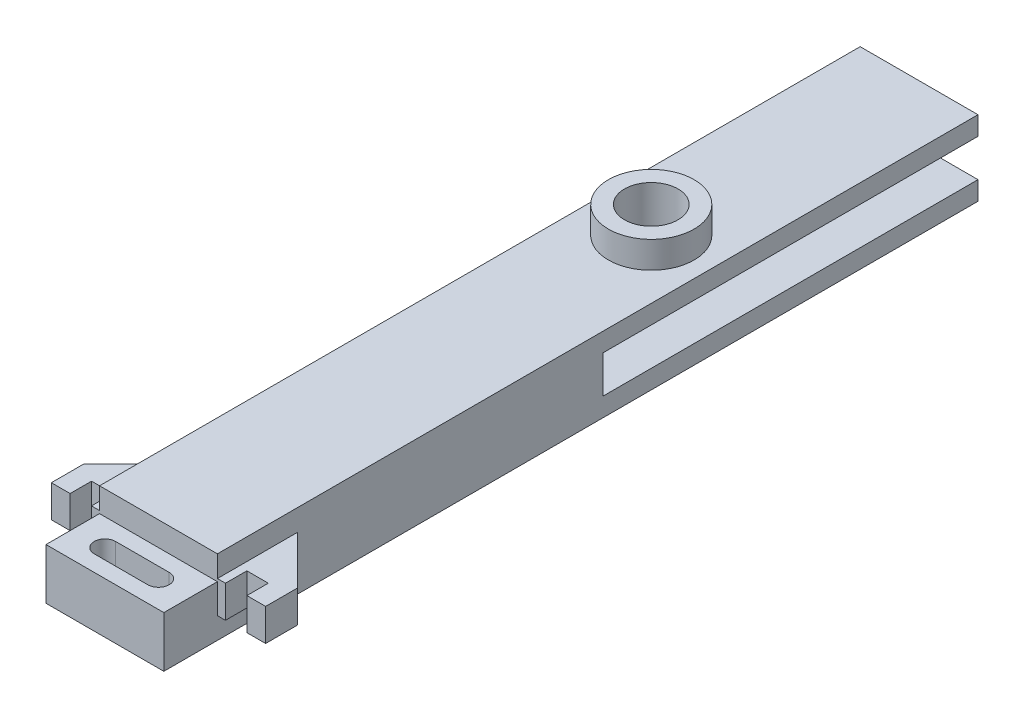
from build123d import *

# Parameters (mm, degrees)
SKETCH1_W           = 11
SKETCH1_H           = 76
BOSS_EXTRUDE1_DEPTH = 7
SKETCH4_R           = 2.5
SKETCH5_W           = 3
SKETCH5_H           = 3
BOSS_EXTRUDE2_DEPTH = 4.5
SKETCH6_W           = 2
SKETCH6_H           = 4
CUT_EXTRUDE2_DEPTH  = 2
BOSS_EXTRUDE3_DEPTH = 3
SKETCH10_W          = 11
SKETCH10_H          = 3.5
CUT_EXTRUDE5_DEPTH  = 35
CUT_EXTRUDE6_REACH  = 41.912
SKETCH11_R          = 2.5
SKETCH12_W          = 11
SKETCH12_H          = 2.25
CUT_EXTRUDE9_DEPTH  = 5
CUT_EXTRUDE10_REACH = 41.58
BOSS_EXTRUDE4_START = 2.5
SKETCH15_R          = 4
SKETCH15_R_2        = 2.5
BOSS_EXTRUDE4_DEPTH = 2.5


with BuildPart() as part:
    # Sketch1 → Boss-Extrude1 (new body)
    with BuildSketch(Plane(origin=(0, 0, 0), x_dir=(1, 0, 0), z_dir=(0, 1, 0))):
        Rectangle(SKETCH1_W, SKETCH1_H)
    extrude(amount=BOSS_EXTRUDE1_DEPTH)

    # Cut-Sweep2: sweep along a path in Sketch3
    with BuildLine(Plane.ZY) as cut_sweep2_path:
        Line((-38, 3.5), (28, 3.5))
        ThreePointArc((28, 3.5), (30.121320344, 2.621320344), (31, 0.5))
        Line((31, 0.5), (31, 0))
    # Sketch4 → Cut-Sweep2 (sweep, cut)
    with BuildSketch(Plane(origin=(0, 0, -38), x_dir=(-1, 0, 0), z_dir=(0, 0, -1))):
        with Locations((0, 3.5)):
            Circle(SKETCH4_R)
    sweep(path=cut_sweep2_path.line, mode=Mode.SUBTRACT)

    # Sketch5 → Boss-Extrude2 (add)
    with BuildSketch(Plane.ZY.offset(5.5)):
        with Locations((31.5, 3.5)):
            Rectangle(SKETCH5_W, SKETCH5_H)
    boss_extrude2 = extrude(amount=BOSS_EXTRUDE2_DEPTH)

    # Mirror1: Boss-Extrude2 across plane
    add(boss_extrude2.mirror(Plane.ZY))

    # Sketch6 → Cut-Extrude2 (cut)
    with BuildSketch(Plane.XY.offset(33)):
        with Locations((-7.25, 4)):
            Rectangle(SKETCH6_W, SKETCH6_H)
    cut_extrude2 = extrude(amount=-CUT_EXTRUDE2_DEPTH, mode=Mode.SUBTRACT)

    # Mirror2: Cut-Extrude2 across plane
    add(cut_extrude2.mirror(Plane.ZY), mode=Mode.SUBTRACT)

    # Sketch7 → Boss-Extrude3 (add)
    with BuildSketch(Plane(origin=(0, 5, 0), x_dir=(1, 0, 0), z_dir=(0, 1, 0))):
        Polygon((-10, -30), (-5.5, -25.5), (-5.5, -30), align=None)
    boss_extrude3 = extrude(amount=-BOSS_EXTRUDE3_DEPTH)

    # Mirror3: Boss-Extrude3 across plane
    add(boss_extrude3.mirror(Plane.ZY))

    # Sketch10 → Cut-Extrude5 (cut)
    with BuildSketch(Plane(origin=(0, 0, -38), x_dir=(-1, 0, 0), z_dir=(0, 0, -1))):
        with Locations((0, 3.5)):
            Rectangle(SKETCH10_W, SKETCH10_H)
    extrude(amount=-CUT_EXTRUDE5_DEPTH, mode=Mode.SUBTRACT)

    # Sketch11 → Cut-Extrude6 (cut, up to next)
    with BuildSketch(Plane(origin=(0, 7, 0), x_dir=(1, 0, 0), z_dir=(0, 1, 0)), mode=Mode.PRIVATE) as cut_extrude6_sk1:
        with Locations(Location((0, 13, 0), (0, 0, 270))):
            Circle(SKETCH11_R)
    cut_extrude6_tool1 = extrude(cut_extrude6_sk1.sketch, amount=-CUT_EXTRUDE6_REACH, mode=Mode.PRIVATE) & part.part
    add(cut_extrude6_tool1.solids().sort_by_distance((0, 7, -13))[0], mode=Mode.SUBTRACT)

    # Sketch12 → Cut-Extrude9 (cut)
    with BuildSketch(Plane.XY.offset(38)):
        with Locations((0, 5.875)):
            Rectangle(SKETCH12_W, SKETCH12_H)
    extrude(amount=-CUT_EXTRUDE9_DEPTH, mode=Mode.SUBTRACT)

    # Sketch14 → Cut-Extrude10 (cut, up to next)
    with BuildSketch(Plane(origin=(0, 4.75, 0), x_dir=(1, 0, 0), z_dir=(0, 1, 0)), mode=Mode.PRIVATE) as cut_extrude10_sk1:
        with BuildLine():
            Line((-2.5, -34.5), (2.5, -34.5))
            ThreePointArc((2.5, -34.5), (3.5, -35.5), (2.5, -36.5))
            Line((2.5, -36.5), (-2.5, -36.5))
            ThreePointArc((-2.5, -36.5), (-3.5, -35.5), (-2.5, -34.5))
        make_face()
    cut_extrude10_tool1 = extrude(cut_extrude10_sk1.sketch, amount=-CUT_EXTRUDE10_REACH, mode=Mode.PRIVATE) & part.part
    add(cut_extrude10_tool1.solids().sort_by_distance((0, 4.75, 35.5))[0], mode=Mode.SUBTRACT)

    # Sketch15 → Boss-Extrude4 (add)
    with BuildSketch(Plane(origin=(0, 7, 0), x_dir=(1, 0, 0), z_dir=(0, 1, 0)).offset(BOSS_EXTRUDE4_START)):
        with Locations(Location((0, 13, 0), (0, 0, 270))):
            Circle(SKETCH15_R)
        with Locations(Location((0, 13, 0), (0, 0, 270))):
            Circle(SKETCH15_R_2, mode=Mode.SUBTRACT)
    extrude(amount=-BOSS_EXTRUDE4_DEPTH)


solid = part.part
